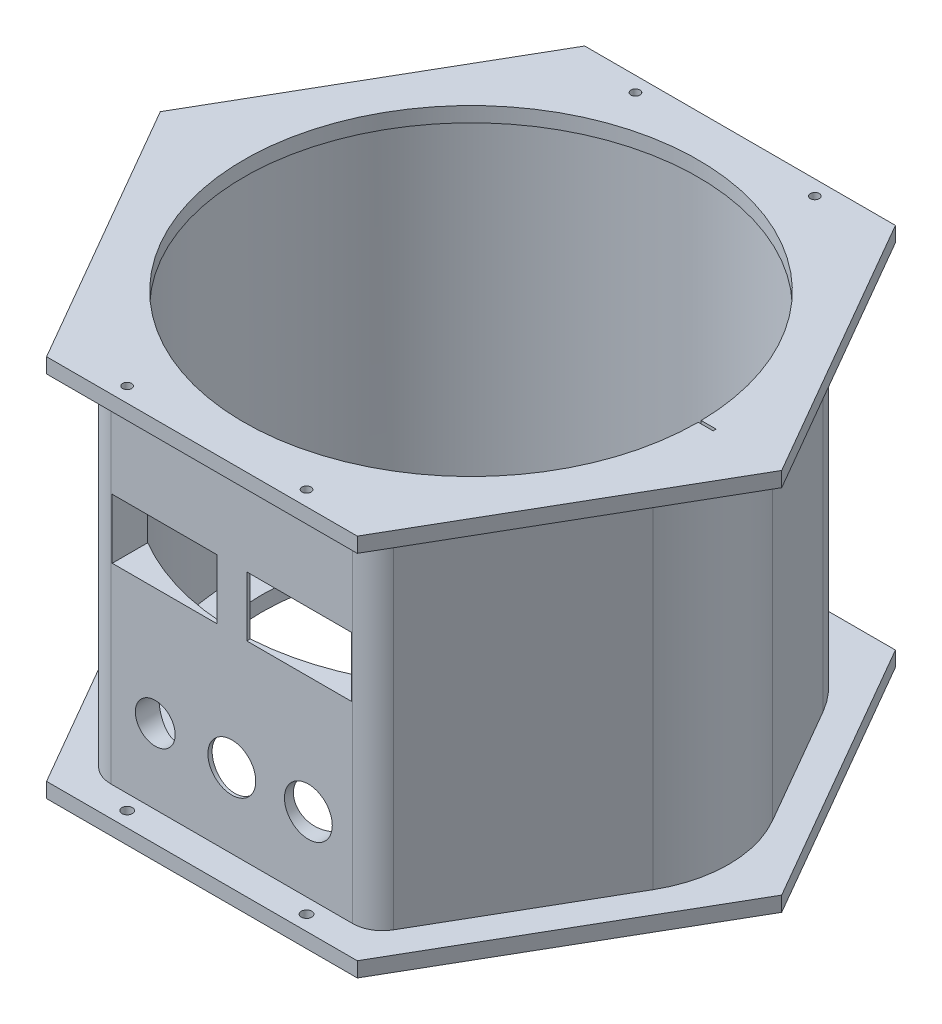
from build123d import *

# Parameters (mm, degrees)
SKETCH1_R           = 79
BOSS_EXTRUDE1_DEPTH = 123
SKETCH2_R           = 70
BOSS_EXTRUDE2_DEPTH = 5
SKETCH3_R           = 76
SKETCH3_R_2         = 1.5
BOSS_EXTRUDE3_DEPTH = 5
SKETCH8_W           = 35
SKETCH8_H           = 20
CUT_EXTRUDE1_DEPTH  = 20
FILLET3_R           = 10
FILLET4_R           = 40
SKETCH12_R          = 1.75
CUT_EXTRUDE3_DEPTH  = 10
CUT_EXTRUDE4_START  = -10
CUT_EXTRUDE4_DEPTH  = 10
SKETCH20_R          = 6.65
SKETCH20_R_2        = 8
CUT_EXTRUDE7_DEPTH  = 22


with BuildPart() as part:
    # Sketch1 → Boss-Extrude1 (new body)
    with BuildSketch(Plane(origin=(0, 0, 0), x_dir=(1, 0, 0), z_dir=(0, 1, 0))):
        Polygon((92.37604307, 0), (46.188021535, 80), (-46.188021535, 80), (-92.37604307, 0), (-46.188021535, -80), (46.188021535, -80), align=None)
        with Locations(Location((0, 0, 0), (0, 0, 270))):
            Circle(SKETCH1_R, mode=Mode.SUBTRACT)
    extrude(amount=BOSS_EXTRUDE1_DEPTH)

    # Sketch3 → Boss-Extrude3 (add)
    with BuildSketch(Plane(origin=(0, 123, 0), x_dir=(1, 0, 0), z_dir=(0, 1, 0))):
        Polygon((103.923048454, 0), (51.961524227, 90), (-51.961524227, 90), (-103.923048454, 0), (-51.961524227, -90), (51.961524227, -90), align=None)
        with Locations(Location((0, 0, 0), (0, 0, 270))):
            Circle(SKETCH3_R, mode=Mode.SUBTRACT)
        with Locations(Location((30, 85, 0), (0, 0, 270))):
            Circle(SKETCH3_R_2, mode=Mode.SUBTRACT)
        with Locations(Location((-30, 85, 0), (0, 0, 270))):
            Circle(SKETCH3_R_2, mode=Mode.SUBTRACT)
        with Locations(Location((30, -85, 0), (0, 0, 270))):
            Circle(SKETCH3_R_2, mode=Mode.SUBTRACT)
        with Locations(Location((-30, -85, 0), (0, 0, 270))):
            Circle(SKETCH3_R_2, mode=Mode.SUBTRACT)
    extrude(amount=BOSS_EXTRUDE3_DEPTH)

    # Sketch8 → Cut-Extrude1 (cut)
    with BuildSketch(Plane.XY.offset(80)):
        with Locations((22.5, 79.151942843)):
            Rectangle(SKETCH8_W, SKETCH8_H)
        with Locations((-22.5, 79.151942843)):
            Rectangle(SKETCH8_W, SKETCH8_H)
    extrude(amount=-CUT_EXTRUDE1_DEPTH, mode=Mode.SUBTRACT)

    # Fillet3
    fillet3_edges = [part.edges().sort_by_distance(p)[0] for p in [
        (46.188021535, 61.5, 80),
        (-46.188021535, 61.5, 80),
    ]]
    fillet(fillet3_edges, radius=FILLET3_R)

    # Fillet4
    fillet4_edges = [part.edges().sort_by_distance(p)[0] for p in [
        (-92.37604307, 61.5, 0),
        (-46.188021535, 61.5, -80),
        (46.188021535, 61.5, -80),
        (92.37604307, 61.5, 0),
    ]]
    fillet(fillet4_edges, radius=FILLET4_R)

    # Sketch16 → Cut-Extrude4 (cut)
    with BuildSketch(Plane(origin=(0, 128, 0), x_dir=(1, 0, 0), z_dir=(0, 1, 0)).offset(CUT_EXTRUDE4_START)):
        with BuildLine():
            ThreePointArc((75.993420768, 1), (75.998355174, 0.500010821), (76, 0))
            Line((76, 0), (81, 0))
            Line((81, 0), (81, 1))
            Line((81, 1), (75.993420768, 1))
        make_face()
    extrude(amount=CUT_EXTRUDE4_DEPTH, mode=Mode.SUBTRACT)

    # Sketch20 → Cut-Extrude7 (cut)
    with BuildSketch(Plane.XY.offset(80)):
        with Locations((-25.6, 30)):
            Circle(SKETCH20_R)
        with Locations((0, 30)):
            Circle(SKETCH20_R_2)
        with Locations((25.6, 30)):
            Circle(SKETCH20_R_2)
    extrude(amount=-CUT_EXTRUDE7_DEPTH, mode=Mode.SUBTRACT)


with BuildPart() as body_2:
    # Sketch2 → Boss-Extrude2 (new body)
    with BuildSketch(Plane.XZ):
        Polygon((103.923048454, 0), (51.961524227, 90), (-51.961524227, 90), (-103.923048454, 0), (-51.961524227, -90), (51.961524227, -90), align=None)
        with Locations(Location((0, 0, 0), (0, 0, 270))):
            Circle(SKETCH2_R, mode=Mode.SUBTRACT)
    extrude(amount=-BOSS_EXTRUDE2_DEPTH)

    # Sketch12 → Cut-Extrude3 (cut)
    with BuildSketch(Plane.XZ):
        with Locations(Location((-30, 85, 0), (0, 0, 270))):
            Circle(SKETCH12_R)
        with Locations(Location((30, 85, 0), (0, 0, 270))):
            Circle(SKETCH12_R)
        with Locations(Location((30, -85, 0), (0, 0, 270))):
            Circle(SKETCH12_R)
        with Locations(Location((-30, -85, 0), (0, 0, 270))):
            Circle(SKETCH12_R)
    extrude(amount=-CUT_EXTRUDE3_DEPTH, mode=Mode.SUBTRACT)


solid = Compound([part.part, body_2.part])
